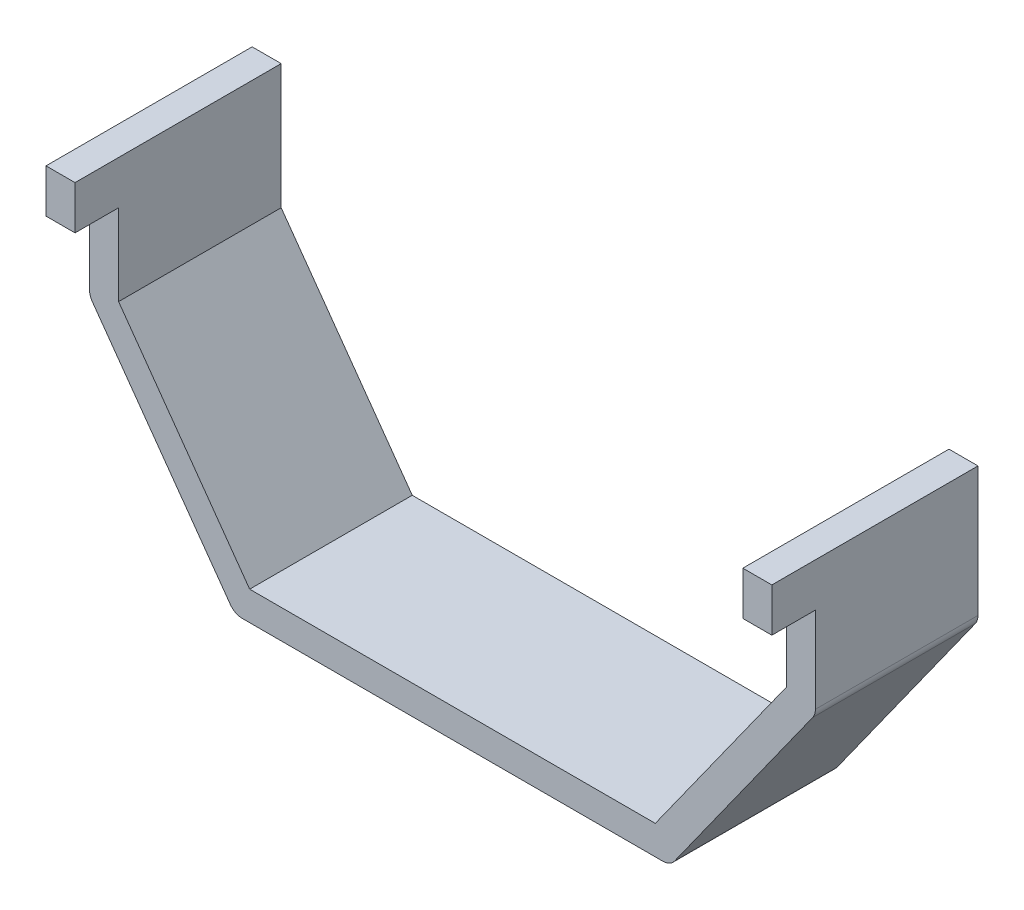
from build123d import *

# Parameters (mm, degrees)
BOSS_EXTRU_1_DEPTH      = 71
ESQUISSE3_W             = 324.913222196
ESQUISSE3_H             = 116.889512864
ENL_V_MAT_EXTRU_2_DEPTH = 15
CONG_1_R                = 5
ESQUISSE4_R             = 2
ENL_V_MAT_EXTRU_3_DEPTH = 8


with BuildPart() as part:
    # Esquisse1 → Boss.-Extru.1 (new body)
    with BuildSketch(Plane.XY):
        Polygon((-124.99814732, 116.197326124), (-114.99814732, 116.197326124), (-114.99814732, 73.201979643), (-69.853824471, 10), (69.854159245, 10), (115.001852666, 73.199624684), (115.001852666, 116.194679298), (125.001852666, 116.194679298), (125.001852666, 69.994679298), (75, 0), (-75, 0), (-124.99814732, 69.997326124), align=None)
    extrude(amount=BOSS_EXTRU_1_DEPTH)

    # Esquisse3 → Enlèv. mat.-Extru.2 (cut)
    with BuildSketch(Plane.XY.offset(71)):
        with Locations((-2.475787976, 42.749922866)):
            Rectangle(ESQUISSE3_W, ESQUISSE3_H)
    extrude(amount=-ENL_V_MAT_EXTRU_2_DEPTH, mode=Mode.SUBTRACT)

    # Congé1
    cong_1_edges = [part.edges().sort_by_distance(p)[0] for p in [
        (125.001852666, 69.994679298, 28),
        (75, 0, 28),
        (-75, 0, 28),
        (-124.99814732, 69.997326124, 28),
    ]]
    fillet(cong_1_edges, radius=CONG_1_R)

    # Esquisse4 → Enlèv. mat.-Extru.3 (cut)
    with BuildSketch(Plane(origin=(0, 0, 0), x_dir=(-1, 0, 0), z_dir=(0, 0, -1))):
        with Locations((-72.427079623, 5)):
            Circle(ESQUISSE4_R)
        with Locations((72.426912235, 5)):
            Circle(ESQUISSE4_R)
        with Locations((-120.001852666, 111.194679298)):
            Circle(ESQUISSE4_R)
        with Locations((119.99814732, 111.197326124)):
            Circle(ESQUISSE4_R)
    extrude(amount=-ENL_V_MAT_EXTRU_3_DEPTH, mode=Mode.SUBTRACT)


solid = part.part
